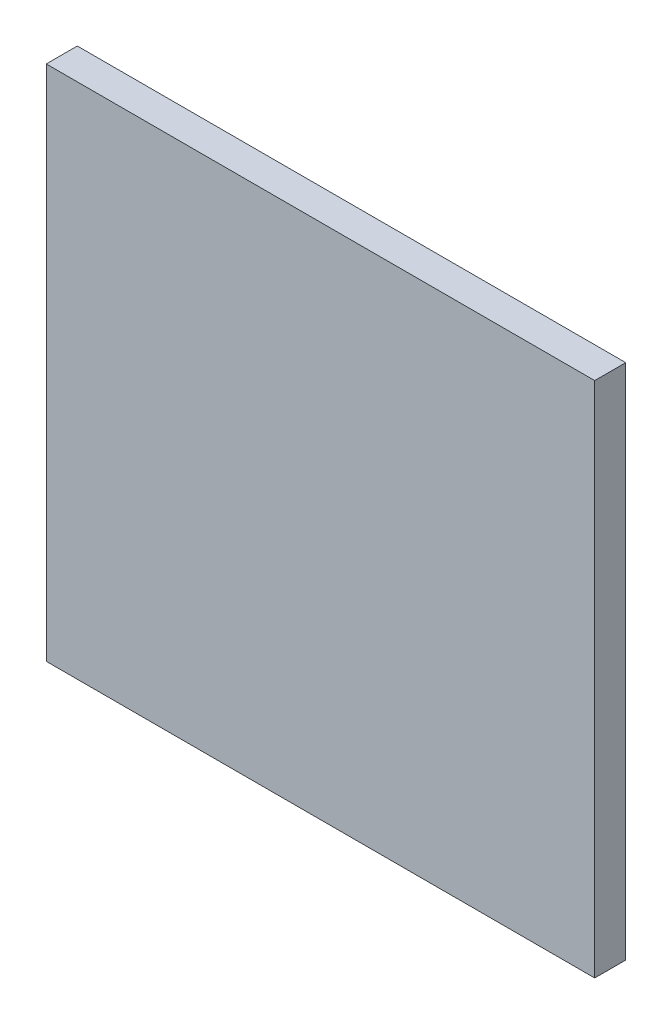
from build123d import *

# Parameters (mm, degrees)
SKETCH1_W           = 53
SKETCH1_H           = 50
BOSS_EXTRUDE1_DEPTH = 3


with BuildPart() as part:
    # Sketch1 → Boss-Extrude1 (new body)
    with BuildSketch(Plane.XY):
        with Locations((-9.514344262, -0.409836066)):
            Rectangle(SKETCH1_W, SKETCH1_H)
    extrude(amount=BOSS_EXTRUDE1_DEPTH)


solid = part.part
